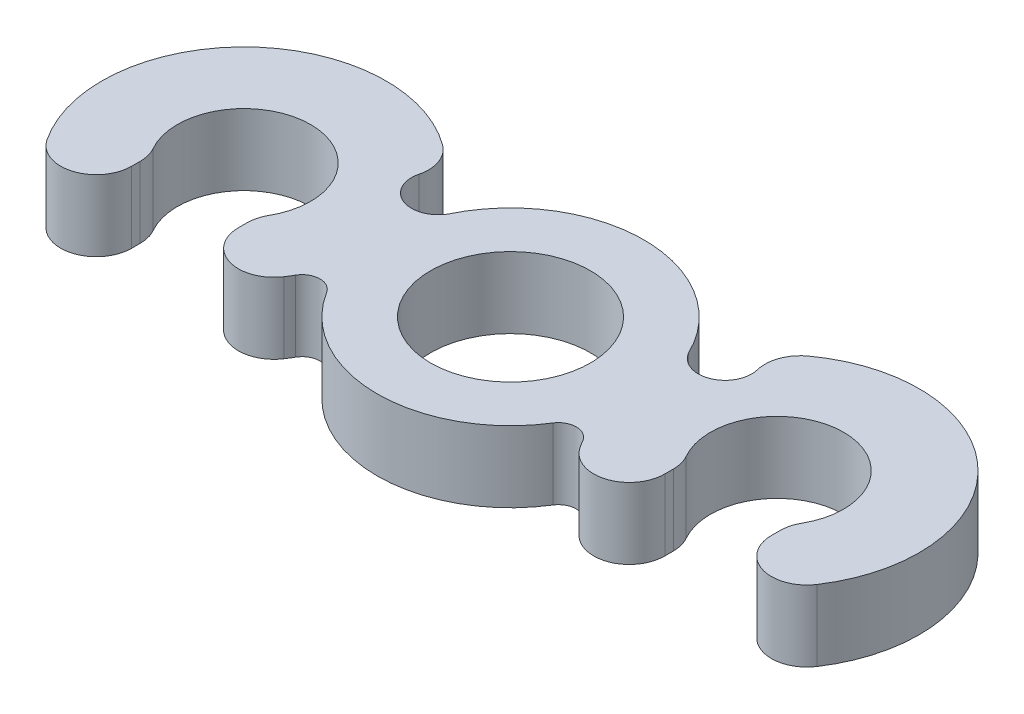
from build123d import *

# Parameters (mm, degrees)
SKIZZE1_R                       = 3.75
AUFSATZ_LINEAR_AUSTRAGEN1_DEPTH = 2
SKIZZE2_R                       = 1.5
SCHNITT_LINEAR_AUSTRAGEN1_DEPTH = 25.677925359
VERRUNDUNG1_R                   = 2
VERRUNDUNG2_R                   = 2
SKIZZE4_R                       = 7.508546114
AUFSATZ_LINEAR_AUSTRAGEN2_DEPTH = 4
SKIZZE5_R                       = 4.5
SCHNITT_LINEAR_AUSTRAGEN3_DEPTH = 25.6779255
VERRUNDUNG4_R                   = 1


with BuildPart() as part:
    # Skizze1 → Aufsatz-Linear austragen1 (new, symmetric)
    with BuildSketch(Plane(origin=(0, 0, 0), x_dir=(1, 0, 0), z_dir=(0, 1, 0))):
        with BuildLine():
            Line((-7.583801513, -3), (0, -3))
            Line((0, -3), (0, 4))
            Line((0, 4), (-8.07179677, 4))
            ThreePointArc((-8.07179677, 4), (-22.980630624, -0.556358556), (-7.583801513, -3))
        make_face()
        with Locations(Location((-15, 0, 0), (0, 0, 270))):
            Circle(SKIZZE1_R, mode=Mode.SUBTRACT)
    extrude(amount=AUFSATZ_LINEAR_AUSTRAGEN1_DEPTH, both=True)

    # Skizze2 → Schnitt-Linear austragen1 (cut, through all)
    with BuildSketch(Plane(origin=(0, 2, 0), x_dir=(1, 0, 0), z_dir=(0, 1, 0))):
        with Locations((-8.07179677, 4)):
            Circle(SKIZZE2_R)
        with BuildLine():
            Line((-12, 0), (-12, -8))
            ThreePointArc((-12, -8), (-15, -11), (-18, -8))
            Line((-18, -8), (-18, 0))
            ThreePointArc((-18, 0), (-15, 3), (-12, 0))
        make_face()
    extrude(amount=-SCHNITT_LINEAR_AUSTRAGEN1_DEPTH, mode=Mode.SUBTRACT)

    # Verrundung1
    verrundung1_edges = [part.edges().sort_by_distance(p)[0] for p in [
        (-8.94027842, 0, -5.223004343),
        (-6.57179677, 0, -4),
        (-18, 0, 2.25),
        (-12, 0, 2.25),
        (-7.583801513, 0, 3),
    ]]
    fillet(verrundung1_edges, radius=VERRUNDUNG1_R)

    # Verrundung2
    verrundung2_edges = [part.edges().sort_by_distance(p)[0] for p in [
        (-12, 0, 7.416198487),
        (-18, 0, 7.416198487),
    ]]
    fillet(verrundung2_edges, radius=VERRUNDUNG2_R)

    # Spiegeln1: part across plane


with BuildPart() as part_1:
    add(part.part)
    add(part.part.mirror(Plane(origin=(0, 2, -4), x_dir=(0, 0, 1), z_dir=(-1, 0, 0))))

    # Skizze4 → Aufsatz-Linear austragen2 (add)
    with BuildSketch(Plane(origin=(0, 2, 0), x_dir=(1, 0, 0), z_dir=(0, 1, 0))):
        Circle(SKIZZE4_R)
    extrude(amount=-AUFSATZ_LINEAR_AUSTRAGEN2_DEPTH)

    # Skizze5 → Schnitt-Linear austragen3 (cut, through all)
    with BuildSketch(Plane(origin=(0, 2, 0), x_dir=(1, 0, 0), z_dir=(0, 1, 0))):
        with Locations(Location((0, 0, 0), (0, 0, 270))):
            Circle(SKIZZE5_R)
    extrude(amount=-SCHNITT_LINEAR_AUSTRAGEN3_DEPTH, mode=Mode.SUBTRACT)

    # Verrundung4
    verrundung4_edges = [part_1.edges().sort_by_distance(p)[0] for p in [
        (6.853540925, 0, 3.06712268),
        (-6.853540925, 0, 3.06712268),
    ]]
    fillet(verrundung4_edges, radius=VERRUNDUNG4_R)


solid = part_1.part
